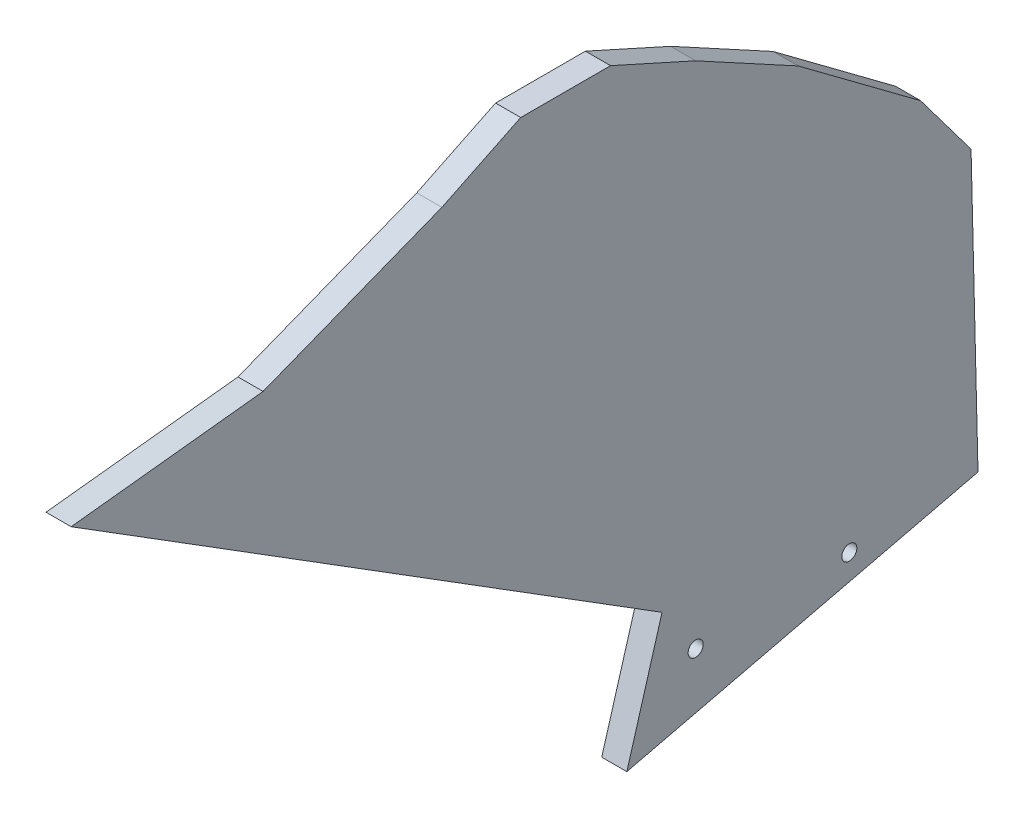
from build123d import *

# Parameters (mm, degrees)
SKETCH_1_R      = 0.6
EXTRUDE_1_DEPTH = 2


with BuildPart() as part:
    # 草图1 → 凸台-拉伸1 (new body)
    with BuildSketch(Plane(origin=(0, 0, 0), x_dir=(0, 0, -1), z_dir=(1, 0, 0))):
        Polygon((-5.483662069, -5.746212595), (22.48689596, 0.939195285), (21.934471639, 23.485878838), (17.91469757, 28.839240511), (8.158406363, 36.115117525), (0, 40.546620882), (-6.780914547, 43.602624476), (-13.936136859, 43.602624476), (-20.210913974, 40.546620882), (-34.455547379, 34.968652147), (-49.745371225, 33.281638151), (-2.678378839, 3.842593198), align=None)
        Circle(SKETCH_1_R, mode=Mode.SUBTRACT)
        with Locations((12.23711119, 0.518510559)):
            Circle(SKETCH_1_R, mode=Mode.SUBTRACT)
    extrude(amount=EXTRUDE_1_DEPTH)


solid = part.part
